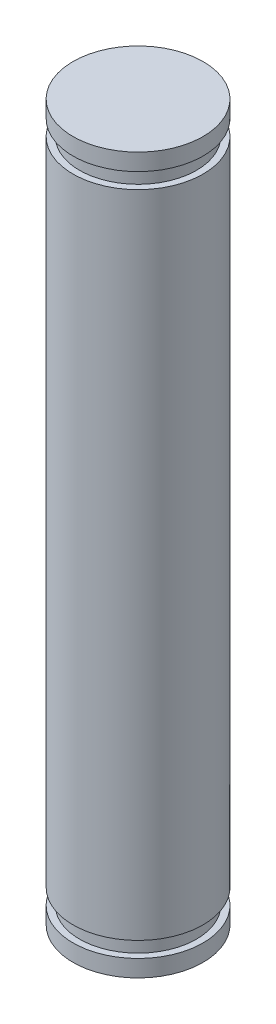
from build123d import *


with BuildPart() as part:
    # 草图1 → 旋转1 (revolve)
    with BuildSketch(Plane.XY, mode=Mode.PRIVATE) as revolve_1_sk:
        Polygon((-6.955644483, 21.114936393), (-11.955644483, 21.114936393), (-11.955644483, 76.114936393), (-6.955644483, 76.114936393), (-6.955644483, 74.814936393), (-7.455644483, 74.814936393), (-7.455644483, 73.614936393), (-6.955644483, 73.614936393), (-6.955644483, 23.614936393), (-7.455644483, 23.614936393), (-7.455644483, 22.414936393), (-6.955644483, 22.414936393), align=None)
    revolve(revolve_1_sk.sketch.rotate(Axis((-11.955644483, 21.114936393, 0), (0, 1, 0)), 90), axis=Axis((-11.955644483, 21.114936393, 0), (0, 1, 0)))


solid = part.part
